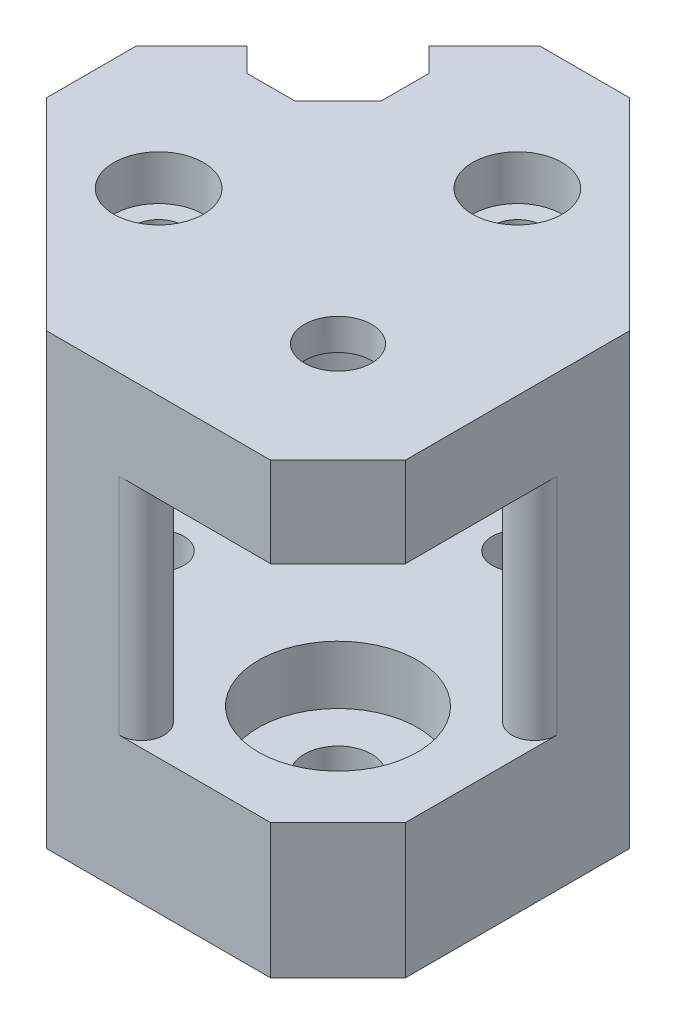
from build123d import *

# Parameters (mm, degrees)
SKETCH9_W           = 36
SKETCH9_H           = 36
BOSS_EXTRUDE1_DEPTH = 40
CHAMFER2_SIZE       = 18
SKETCH10_W          = 36
SKETCH10_H          = 40
BOSS_EXTRUDE2_DEPTH = 8
SKETCH12_W          = 44
SKETCH12_H          = 40
BOSS_EXTRUDE3_DEPTH = 8
CHAMFER3_SIZE       = 18
CHAMFER4_SIZE       = 6
SKETCH13_W          = 36.769552622
SKETCH13_H          = 20
CUT_EXTRUDE6_DEPTH  = 39.59798
SKETCH14_R          = 3
CUT_EXTRUDE7_DEPTH  = 70.512588881
SKETCH15_R          = 7.1
CUT_EXTRUDE8_DEPTH  = 5.2
CUT_EXTRUDE9_START  = -5.2
SKETCH16_R          = 7.1
CUT_EXTRUDE9_DEPTH  = 5.2
BOSS_EXTRUDE4_DEPTH = 20
FILLET1_R           = 2
SKETCH19_R          = 2.25
CUT_EXTRUDE10_DEPTH = 70.512588881
SKETCH20_R          = 2.8
CUT_EXTRUDE11_DEPTH = 7
SKETCH21_R          = 4
CUT_EXTRUDE12_DEPTH = 4
SKETCH22_R          = 2.1
CUT_EXTRUDE13_DEPTH = 6
SKETCH23_W          = 11.455844123
SKETCH23_H          = 40
CUT_EXTRUDE14_DEPTH = 6
CHAMFER5_SIZE       = 3


with BuildPart() as part:
    # Sketch9 → Boss-Extrude1 (new body)
    with BuildSketch(Plane(origin=(0, 0, 0), x_dir=(1, 0, 0), z_dir=(0, 1, 0))):
        with Locations((18, 18)):
            Rectangle(SKETCH9_W, SKETCH9_H)
    extrude(amount=BOSS_EXTRUDE1_DEPTH)

    # Chamfer2
    chamfer2_edges = [part.edges().sort_by_distance(p)[0] for p in [
        (0, 20, -36),
    ]]
    chamfer(chamfer2_edges, length=CHAMFER2_SIZE)

    # Sketch10 → Boss-Extrude2 (add)
    with BuildSketch(Plane(origin=(36, 0, 0), x_dir=(0, 0, -1), z_dir=(1, 0, 0))):
        with Locations((18, 20)):
            Rectangle(SKETCH10_W, SKETCH10_H)
    extrude(amount=BOSS_EXTRUDE2_DEPTH)

    # Sketch12 → Boss-Extrude3 (add)
    with BuildSketch(Plane.XY):
        with Locations((22, 20)):
            Rectangle(SKETCH12_W, SKETCH12_H)
    extrude(amount=BOSS_EXTRUDE3_DEPTH)

    # Chamfer3
    chamfer3_edges = [part.edges().sort_by_distance(p)[0] for p in [
        (44, 20, -36),
        (0, 20, 8),
    ]]
    chamfer(chamfer3_edges, length=CHAMFER3_SIZE)

    # Chamfer4
    chamfer4_edges = [part.edges().sort_by_distance(p)[0] for p in [
        (44, 20, 8),
    ]]
    chamfer(chamfer4_edges, length=CHAMFER4_SIZE)

    # Sketch13 → Cut-Extrude6 (cut)
    with BuildSketch(Plane(origin=(23, 0, 23), x_dir=(0.7071067811865465, 0, -0.7071067811865487), z_dir=(0.7071067811865487, 0, 0.7071067811865465))):
        with Locations((25.455844123, 22)):
            Rectangle(SKETCH13_W, SKETCH13_H)
    extrude(amount=-CUT_EXTRUDE6_DEPTH, mode=Mode.SUBTRACT)

    # Sketch14 → Cut-Extrude7 (cut, through all)
    with BuildSketch(Plane(origin=(0, 40, 0), x_dir=(1, 0, 0), z_dir=(0, 1, 0))):
        with Locations(Location((32, 4, 0), (0, 0, 270))):
            Circle(SKETCH14_R)
    extrude(amount=-CUT_EXTRUDE7_DEPTH, mode=Mode.SUBTRACT)

    # Sketch15 → Cut-Extrude8 (cut)
    with BuildSketch(Plane(origin=(0, 12, 0), x_dir=(1, 0, 0), z_dir=(0, 1, 0))):
        with Locations(Location((32, 4, 0), (0, 0, 270))):
            Circle(SKETCH15_R)
    extrude(amount=-CUT_EXTRUDE8_DEPTH, mode=Mode.SUBTRACT)

    # Sketch16 → Cut-Extrude9 (cut)
    with BuildSketch(Plane(origin=(0, 32, 0), x_dir=(-1, 0, 0), z_dir=(0, -1, 0)).offset(CUT_EXTRUDE9_START)):
        with Locations(Location((-32, 4, 0), (0, 0, 270))):
            Circle(SKETCH16_R)
    extrude(amount=CUT_EXTRUDE9_DEPTH, mode=Mode.SUBTRACT)

    # Sketch18 → Boss-Extrude4 (add)
    with BuildSketch(Plane(origin=(0, 12, 0), x_dir=(1, 0, 0), z_dir=(0, 1, 0))):
        Polygon((40.464466094, 21.535533906), (34.807611845, 15.878679656), (44, 6.686291501), (44, 18), align=None)
        Polygon((14.464466094, -4.464466094), (20.121320344, 1.192388155), (29.313708499, -8), (18, -8), align=None)
    extrude(amount=BOSS_EXTRUDE4_DEPTH)

    # Fillet1
    fillet1_edges = [part.edges().sort_by_distance(p)[0] for p in [
        (14.464466094, 22, 4.464466094),
        (29.313708499, 22, 8),
        (20.121320344, 22, -1.192388155),
        (44, 22, -6.686291501),
        (40.464466094, 22, -21.535533906),
        (34.807611845, 22, -15.878679656),
    ]]
    fillet(fillet1_edges, radius=FILLET1_R)

    # Sketch19 → Cut-Extrude10 (cut, through all)
    with BuildSketch(Plane(origin=(0, 40, 0), x_dir=(1, 0, 0), z_dir=(0, 1, 0))):
        with Locations(Location((12, 8, 0), (0, 0, 270))):
            Circle(SKETCH19_R)
        with Locations(Location((28, 24, 0), (0, 0, 270))):
            Circle(SKETCH19_R)
    extrude(amount=-CUT_EXTRUDE10_DEPTH, mode=Mode.SUBTRACT)

    # Sketch20 → Cut-Extrude11 (cut)
    with BuildSketch(Plane(origin=(0, 0, 0), x_dir=(-1, 0, 0), z_dir=(0, -1, 0))):
        with Locations(Location((-12, 8, 0), (0, 0, 90))):
            Circle(SKETCH20_R)
        with Locations(Location((-28, 24, 0), (0, 0, 90))):
            Circle(SKETCH20_R)
    extrude(amount=-CUT_EXTRUDE11_DEPTH, mode=Mode.SUBTRACT)

    # Sketch21 → Cut-Extrude12 (cut)
    with BuildSketch(Plane(origin=(0, 40, 0), x_dir=(1, 0, 0), z_dir=(0, 1, 0))):
        with Locations(Location((28, 24, 0), (0, 0, 270))):
            Circle(SKETCH21_R)
        with Locations(Location((12, 8, 0), (0, 0, 270))):
            Circle(SKETCH21_R)
    extrude(amount=-CUT_EXTRUDE12_DEPTH, mode=Mode.SUBTRACT)

    # Sketch22 → Cut-Extrude13 (cut)
    with BuildSketch(Plane(origin=(-9, 0, -9), x_dir=(-0.7071067811865487, 0, 0.7071067811865465), z_dir=(-0.7071067811865465, 0, -0.7071067811865487))):
        with Locations((-15.455844123, 36)):
            Circle(SKETCH22_R)
        with Locations((-35.455844123, 36)):
            Circle(SKETCH22_R)
        with Locations((-35.455844123, 4)):
            Circle(SKETCH22_R)
        with Locations((-15.455844123, 4)):
            Circle(SKETCH22_R)
    extrude(amount=-CUT_EXTRUDE13_DEPTH, mode=Mode.SUBTRACT)

    # Sketch23 → Cut-Extrude14 (cut)
    with BuildSketch(Plane(origin=(-9, 0, -9), x_dir=(-0.7071067811865487, 0, 0.7071067811865465), z_dir=(-0.7071067811865465, 0, -0.7071067811865487))):
        with Locations((-25.455844123, 20)):
            Rectangle(SKETCH23_W, SKETCH23_H)
    extrude(amount=-CUT_EXTRUDE14_DEPTH, mode=Mode.SUBTRACT)

    # Chamfer5
    chamfer5_edges = [part.edges().sort_by_distance(p)[0] for p in [
        (17.292893219, 6, -26.807611845),
        (9.192388155, 6, -18.707106781),
    ]]
    chamfer(chamfer5_edges, length=CHAMFER5_SIZE)


solid = part.part
